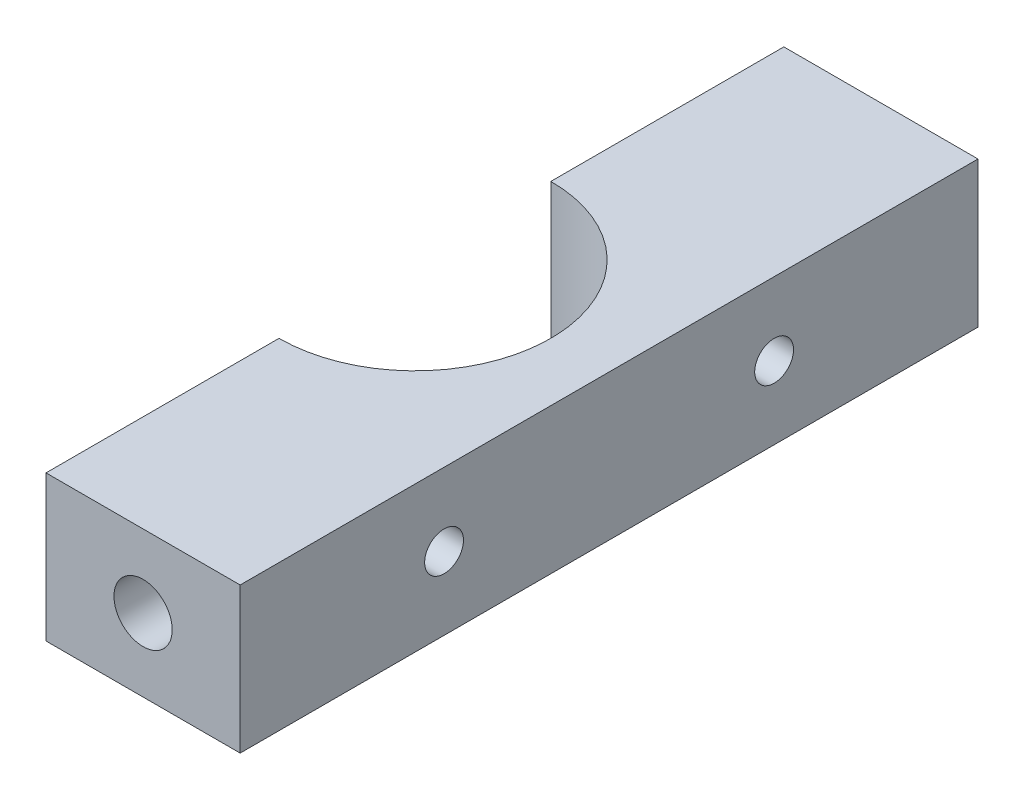
from build123d import *

# Parameters (mm, degrees)
EXTRUDE_1_DEPTH     = 15
SKETCH_3_R          = 2
CUT_EXTRUDE_3_DEPTH = 61
SKETCH_5_R          = 3
CUT_EXTRUDE_4_DEPTH = 17
CUT_EXTRUDE_START   = 17
SKETCH_6_R          = 3
CUT_EXTRUDE_5_DEPTH = 17


with BuildPart() as part:
    # Эскиз1 → Вытянуть1 (new body)
    with BuildSketch(Plane(origin=(0, 0, 0), x_dir=(1, 0, 0), z_dir=(0, 1, 0))):
        with BuildLine():
            Line((0, -14), (0, -38))
            Line((0, -38), (20.00009991, -38))
            Line((20.00009991, -38), (20.00009991, 38))
            Line((20.00009991, 38), (0, 38))
            Line((0, 38), (0, 14))
            ThreePointArc((0, 14), (14, 0), (0, -14))
        make_face()
    extrude(amount=EXTRUDE_1_DEPTH)

    # Эскиз3 → Вырез-Вытянуть3 (cut, symmetric)
    with BuildSketch(Plane(origin=(20.00009991, 0, 0), x_dir=(0, 0, -1), z_dir=(1, 0, 0))):
        with Locations((-17, 7.5)):
            Circle(SKETCH_3_R)
        with Locations((17, 7.5)):
            Circle(SKETCH_3_R)
    extrude(amount=CUT_EXTRUDE_3_DEPTH, both=True, mode=Mode.SUBTRACT)

    # Эскиз5 → Вырез-Вытянуть4 (cut)
    with BuildSketch(Plane.XY.offset(38)):
        with Locations((10, 7.5)):
            Circle(SKETCH_5_R)
    extrude(amount=-CUT_EXTRUDE_4_DEPTH, mode=Mode.SUBTRACT)

    # Эскиз6 → Вырез-Вытянуть5 (cut)
    with BuildSketch(Plane.XY.offset(-38).offset(CUT_EXTRUDE_START)):
        with Locations((10, 7.5)):
            Circle(SKETCH_6_R)
    extrude(amount=-CUT_EXTRUDE_5_DEPTH, mode=Mode.SUBTRACT)


solid = part.part
